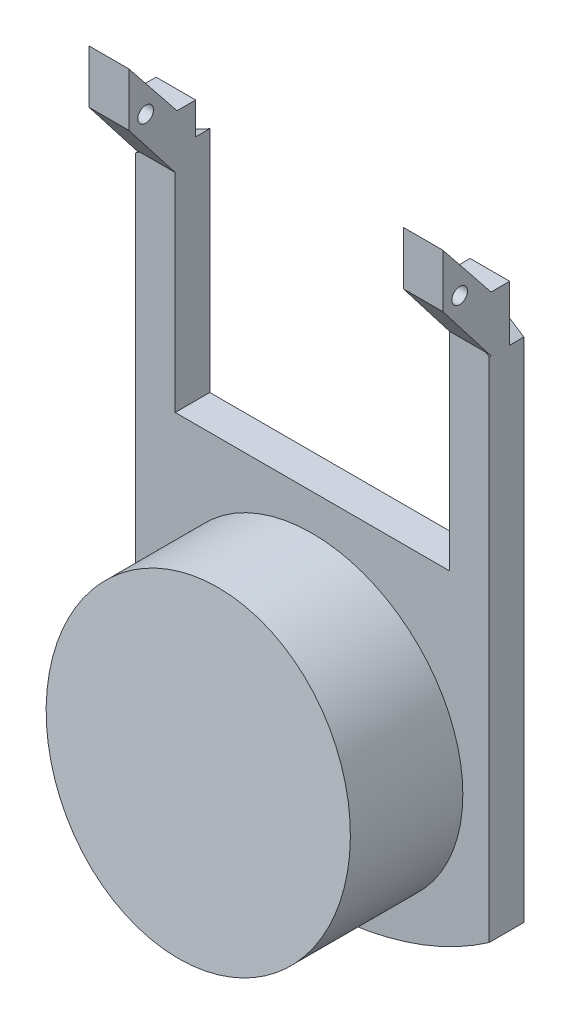
from build123d import *

# Parameters (mm, degrees)
LID_PROFILE_DEPTH           = 3.556
SKETCH2_R                   = 15.494
MOUTHPIECE_COVER_DEPTH      = 13.716
SKETCH5_R                   = 13.589
MOUTHPIECE_INSIDE_DEPTH     = 12.7
MOUTHPIECE_ANGLED_CUT_DEPTH = 31.75
LEFT_LID_HANDLE_REACH       = 54.989
RIGHT_LID_HANDLE_REACH      = 59.215
CUT_EXTRUDE1_REACH          = 61.6
SKETCH15_R                  = 0.803296428


with BuildPart() as part:
    # Sketch1 → Lid Profile (new body)
    with BuildSketch(Plane.XY):
        with BuildLine():
            Line((0, 34.499663168), (0, 21.545663168))
            Line((0, 21.545663168), (0, 11.032242365))
            Line((0, 11.032242365), (28.194, 11.032242365))
            Line((28.194, 11.032242365), (28.194, 21.545663168))
            Line((28.194, 21.545663168), (28.194, 34.499663168))
            ThreePointArc((28.194, 34.499663168), (30.270793835, 33.37243225), (32.258, 32.093865147))
            Line((32.258, 32.093865147), (32.258, -19.992239679))
            ThreePointArc((32.258, -19.992239679), (14.097, -25.699187266), (-4.064, -19.992239679))
            Line((-4.064, -19.992239679), (-4.064, 32.093865147))
            ThreePointArc((-4.064, 32.093865147), (-2.076793835, 33.37243225), (0, 34.499663168))
        make_face()
    extrude(amount=LID_PROFILE_DEPTH)

    # Sketch2 → Mouthpiece Cover (add)
    with BuildSketch(Plane.XY.offset(3.556)):
        with Locations((14.054185991, -8.173187266)):
            Circle(SKETCH2_R)
    extrude(amount=MOUTHPIECE_COVER_DEPTH)

    # Sketch5 → Mouthpiece Inside (cut)
    with BuildSketch(Plane(origin=(0, 0, 0), x_dir=(-1, 0, 0), z_dir=(0, 0, -1))):
        with Locations((-14.097, -8.173187266)):
            Circle(SKETCH5_R)
    extrude(amount=-MOUTHPIECE_INSIDE_DEPTH, mode=Mode.SUBTRACT)

    # Sketch12 → Mouthpiece Angled Cut (cut, symmetric)
    with BuildSketch(Plane(origin=(0, 0, 0), x_dir=(0, 0, -1), z_dir=(1, 0, 0))):
        Polygon((-17.272, -23.667187266), (-13.208, 7.320812734), (-17.272, 7.320812734), align=None)
    extrude(amount=MOUTHPIECE_ANGLED_CUT_DEPTH, both=True, mode=Mode.SUBTRACT)

    # Left Lid Handle: up to this face of the body (flat: up to its plane)
    left_lid_handle_end = Plane(part.part.faces().sort_by_distance((0, 22.765952767, 1.778))[0])
    # Sketch10 → Left Lid Handle (add, up to the picked face)
    with BuildSketch(Plane.ZY.offset(4.064), mode=Mode.PRIVATE) as left_lid_handle_sk1:
        Polygon((3.365795212, 32.138217174), (8.321348051, 38.515411016), (8.321348051, 43.984174588), (3.365795212, 37.782280768), (1.455115312, 37.782280768), (1.455115312, 28.897562955), (3.365795212, 28.897562955), align=None)
    left_lid_handle_tool1 = split(extrude(left_lid_handle_sk1.sketch, amount=-LEFT_LID_HANDLE_REACH, mode=Mode.PRIVATE), bisect_by=left_lid_handle_end, keep=Keep.BOTH, mode=Mode.PRIVATE)
    add(left_lid_handle_tool1.solids().sort_by(Axis((-4.064, 36.27745, 4.52617), (1, 0, 0)))[0])

    # Right Lid Handle: up to this face of the body (flat: up to its plane)
    right_lid_handle_end = Plane(part.part.faces().sort_by_distance((32.258, 6.050812734, 1.778))[0])
    # Sketch14 → Right Lid Handle (add, up to the picked face)
    with BuildSketch(Plane.ZY.offset(-28.194), mode=Mode.PRIVATE) as right_lid_handle_sk1:
        Polygon((8.321348051, 43.984174588), (8.321348051, 38.515411016), (3.365795212, 32.093865147), (3.302, 26.626354669), (1.53624021, 26.626354669), (1.455115312, 37.782280768), (3.365795212, 37.782280768), align=None)
    right_lid_handle_tool1 = split(extrude(right_lid_handle_sk1.sketch, amount=-RIGHT_LID_HANDLE_REACH, mode=Mode.PRIVATE), bisect_by=right_lid_handle_end, keep=Keep.BOTH, mode=Mode.PRIVATE)
    add(right_lid_handle_tool1.solids().sort_by(Axis((28.194, 35.592076, 4.370093), (1, 0, 0)))[0])

    # Cut-Extrude1: up to this face of the body (flat: up to its plane)
    cut_extrude1_end = Plane(part.part.faces().sort_by_distance((32.258, 11.399042149, 2.309511507))[0])
    # Sketch15 → Cut-Extrude1 (cut, up to the picked face)
    with BuildSketch(Plane.ZY.offset(4.064), mode=Mode.PRIVATE) as cut_extrude1_sk1:
        with Locations(Location((6.586858653, 39.082697022, 0), (0, 0, 270))):
            Circle(SKETCH15_R)
    cut_extrude1_tool1 = split(extrude(cut_extrude1_sk1.sketch, amount=-CUT_EXTRUDE1_REACH, mode=Mode.PRIVATE), bisect_by=cut_extrude1_end, keep=Keep.BOTH, mode=Mode.PRIVATE)
    add(cut_extrude1_tool1.solids().sort_by(Axis((-4.064, 39.082697, 6.586859), (1, 0, 0)))[0], mode=Mode.SUBTRACT)


solid = part.part
